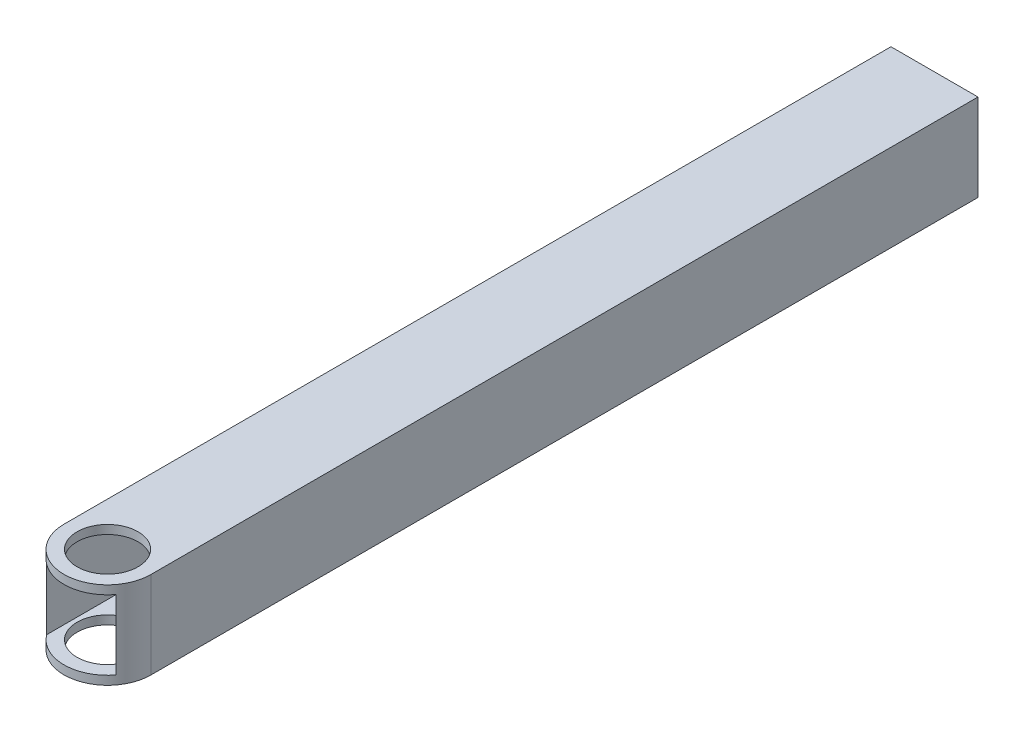
from build123d import *

# Parameters (mm, degrees)
SKETCH_1_W          = 10
SKETCH_1_H          = 10
SKETCH_1_W_2        = 8
SKETCH_1_H_2        = 8
EXTRUDE_1_DEPTH     = 100
SKETCH_2_R          = 3.5
CUT_EXTRUDE_1_DEPTH = 100


with BuildPart() as part:
    # ｽｹｯﾁ1 → ﾎﾞｽ - 押し出し1 (new body)
    with BuildSketch(Plane.XY):
        Rectangle(SKETCH_1_W, SKETCH_1_H)
        Rectangle(SKETCH_1_W_2, SKETCH_1_H_2, mode=Mode.SUBTRACT)
    extrude(amount=EXTRUDE_1_DEPTH)

    # ｽｹｯﾁ2 → ｶｯﾄ - 押し出し1 (cut)
    with BuildSketch(Plane(origin=(0, 5, 0), x_dir=(1, 0, 0), z_dir=(0, 1, 0))):
        with Locations(Location((0, -95, 0), (0, 0, 270))):
            Circle(SKETCH_2_R)
        with BuildLine():
            Line((-5, -95), (-5, -103))
            Line((-5, -103), (5, -103))
            Line((5, -103), (5, -95))
            ThreePointArc((5, -95), (0, -100), (-5, -95))
        make_face()
    extrude(amount=-CUT_EXTRUDE_1_DEPTH, mode=Mode.SUBTRACT)


solid = part.part
